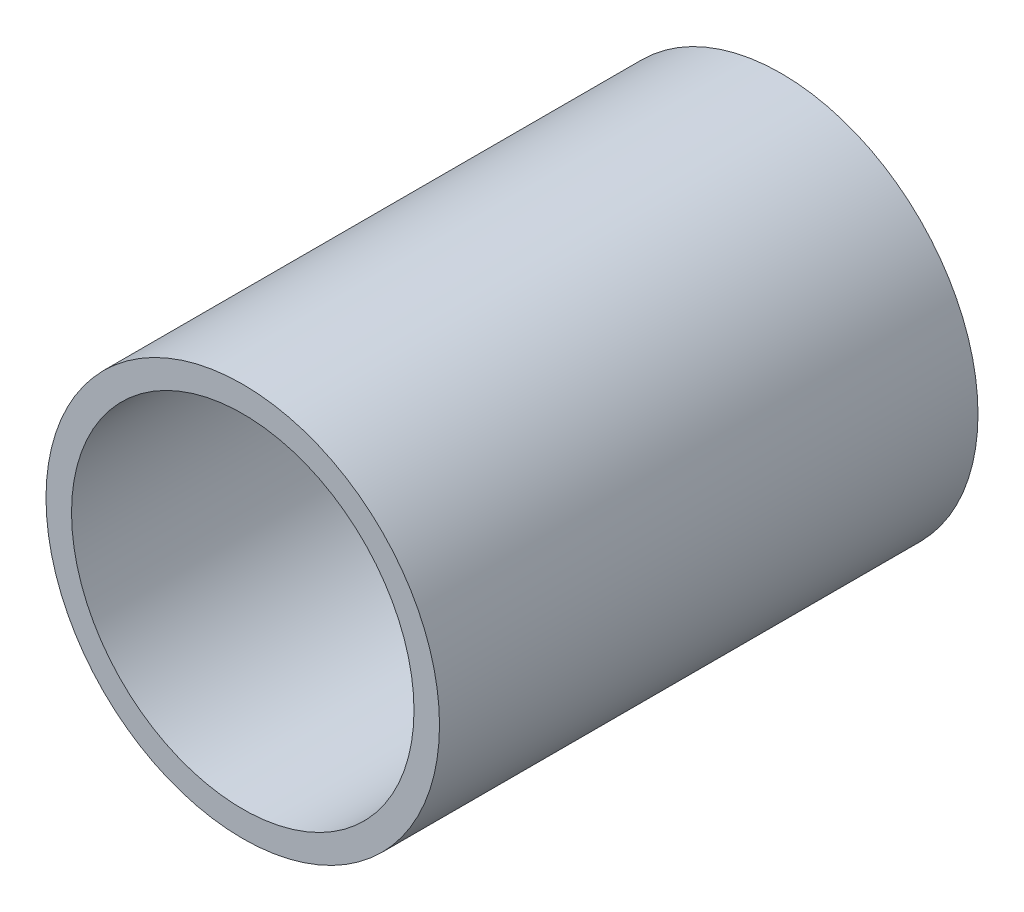
from build123d import *

# Parameters (mm, degrees)
SKETCH1_R           = 30.1625
SKETCH1_R_2         = 26.2509
BOSS_EXTRUDE1_DEPTH = 82.55


with BuildPart() as part:
    # Sketch1 → Boss-Extrude1 (new body)
    with BuildSketch(Plane.XY):
        Circle(SKETCH1_R)
        Circle(SKETCH1_R_2, mode=Mode.SUBTRACT)
    extrude(amount=BOSS_EXTRUDE1_DEPTH)


solid = part.part
